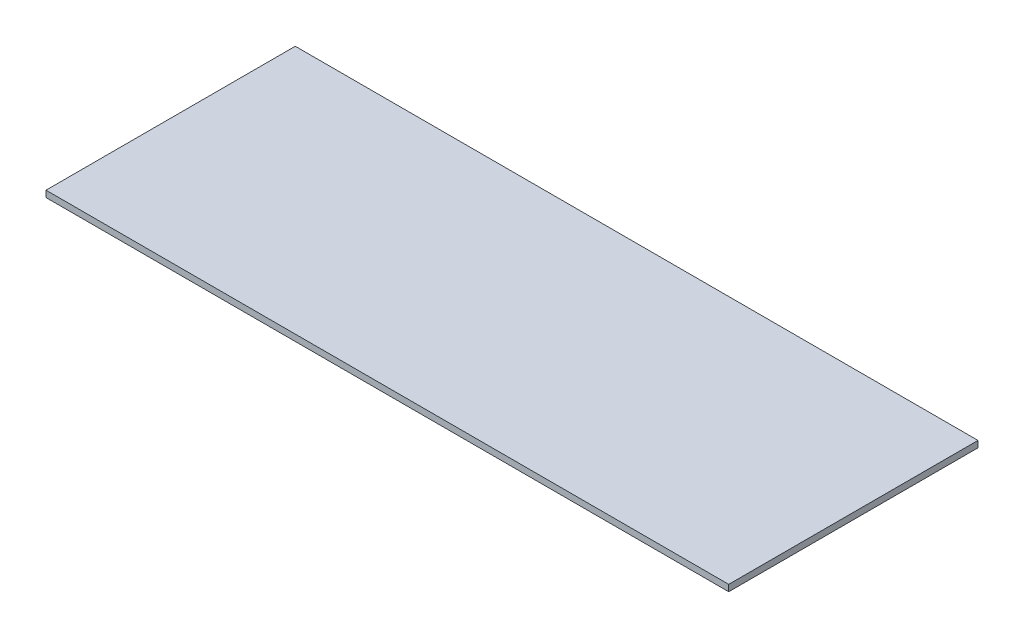
from build123d import *

# Parameters (mm, degrees)
SKETCH1_W           = 506.09999999
SKETCH1_H           = 184.792366
BOSS_EXTRUDE2_DEPTH = 4.7625


with BuildPart() as part:
    # Sketch1 → Boss-Extrude2 (new body)
    with BuildSketch(Plane(origin=(0, 0, 0), x_dir=(1, 0, 0), z_dir=(0, 1, 0))):
        with Locations((193.921051808, 63.995664579)):
            Rectangle(SKETCH1_W, SKETCH1_H)
    extrude(amount=BOSS_EXTRUDE2_DEPTH)


solid = part.part
